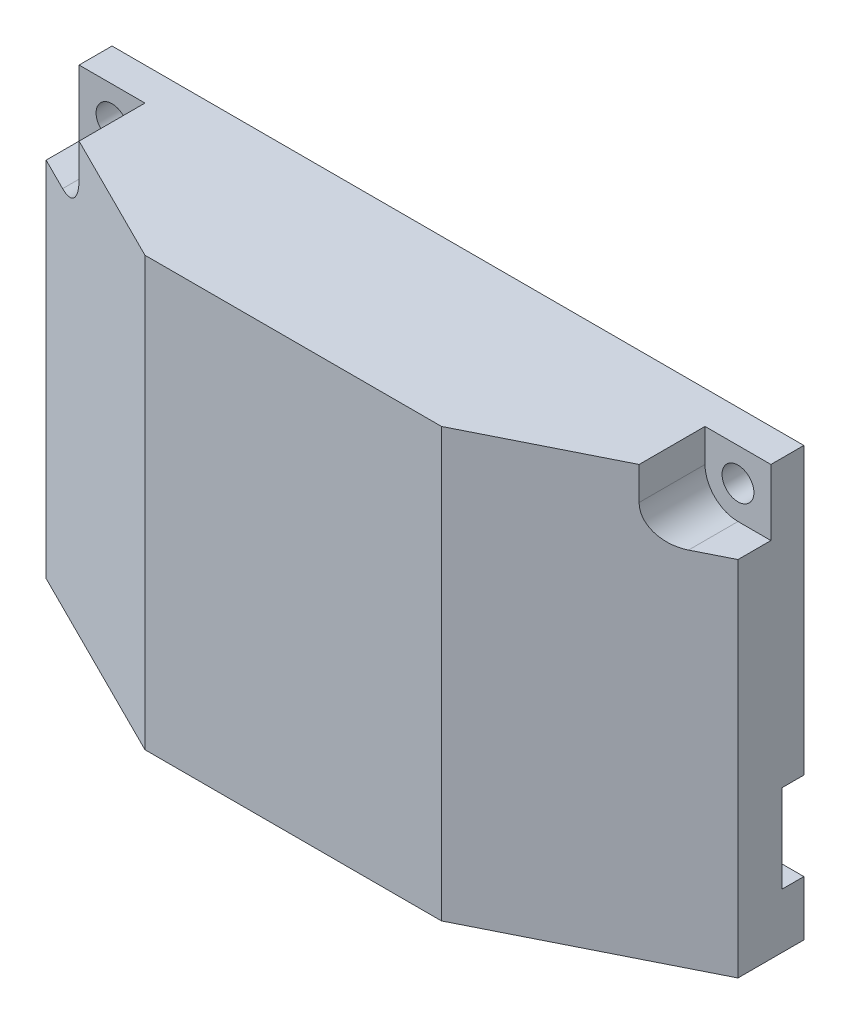
from build123d import *

# Parameters (mm, degrees)
SALIENTE_EXTRUIR1_DEPTH    = 15
CORTAR_EXTRUIR1_DEPTH      = 10
CORTAR_EXTRUIR1_DEPTH_BACK = 39
VACIADO1_T                 = -2
SALIENTE_EXTRUIR2_DEPTH    = 10
CORTAR_EXTRUIR2_DEPTH      = 39
CROQUIS9_R                 = 1.45
CORTAR_EXTRUIR3_DEPTH      = 33
CORTAR_EXTRUIR4_DEPTH      = 12
CROQUIS11_W                = 2
CROQUIS11_H                = 8
CORTAR_EXTRUIR5_DEPTH      = 2
CROQUIS14_R                = 3
SALIENTE_EXTRUIR3_DEPTH    = 8
CROQUIS15_R                = 1.45
CORTAR_EXTRUIR6_DEPTH      = 8


with BuildPart() as part:
    # Croquis1 → Saliente-Extruir1 (new body)
    with BuildSketch(Plane.XY):
        Polygon((0, 0), (0, 33), (63, 33), (63, 0), (63, -6), (0, -6), align=None)
    extrude(amount=SALIENTE_EXTRUIR1_DEPTH)

    # Croquis2 → Cortar-Extruir1 (cut, two sides: drawn at the far end of the back side and taken through both)
    with BuildSketch(Plane.XZ.offset(6).offset(-CORTAR_EXTRUIR1_DEPTH_BACK)):
        Polygon((0, 15), (0, 6), (18, 15), align=None)
        Polygon((63, 15), (63, 6), (45, 15), align=None)
    extrude(amount=CORTAR_EXTRUIR1_DEPTH + CORTAR_EXTRUIR1_DEPTH_BACK, mode=Mode.SUBTRACT)

    # Vaciado1
    vaciado1_openings = [part.faces().sort_by_distance(p)[0] for p in [
        (31.5, 13.5, 0),
    ]]
    offset(amount=VACIADO1_T, openings=vaciado1_openings, kind=Kind.INTERSECTION)

    # Croquis3 → Saliente-Extruir2 (add)
    with BuildSketch(Plane(origin=(0, 0, 0), x_dir=(-1, 0, 0), z_dir=(0, 0, -1))):
        with BuildLine():
            Line((-63, 30), (-63, 27.354248689))
            ThreePointArc((-63, 27.354248689), (-58.125593258, 26.466361738), (-56.127016654, 31))
            Line((-56.127016654, 31), (-57.171572875, 31))
            ThreePointArc((-57.171572875, 31), (-60.507305936, 32.956795679), (-63, 30))
        make_face()
        with BuildLine():
            Line((-6.872983346, 31), (-5.828427125, 31))
            ThreePointArc((-5.828427125, 31), (-0.878679656, 32.121320344), (-2, 27.171572875))
            Line((-2, 27.171572875), (-2, 26.127016654))
            ThreePointArc((-2, 26.127016654), (-5.828427125, 27.171572875), (-6.872983346, 31))
        make_face()
    extrude(amount=-SALIENTE_EXTRUIR2_DEPTH)

    # Croquis8 → Cortar-Extruir2 (cut)
    with BuildSketch(Plane.XZ.offset(6)):
        Polygon((0, 6), (0, 18.606217888), (63, 18.606217888), (63, 6), (45, 15), (18, 15), align=None)
    extrude(amount=-CORTAR_EXTRUIR2_DEPTH, mode=Mode.SUBTRACT)

    # Croquis9 → Cortar-Extruir3 (cut)
    with BuildSketch(Plane(origin=(0, 0, 0), x_dir=(-1, 0, 0), z_dir=(0, 0, -1))):
        with Locations((-60, 30)):
            Circle(CROQUIS9_R)
        with Locations((-3, 30)):
            Circle(CROQUIS9_R)
    extrude(amount=-CORTAR_EXTRUIR3_DEPTH, mode=Mode.SUBTRACT)

    # Croquis10 → Cortar-Extruir4 (cut)
    with BuildSketch(Plane.XY.offset(15)):
        with BuildLine():
            Line((6, 30), (6, 33))
            Line((6, 33), (0, 33))
            Line((0, 33), (0, 27))
            Line((0, 27), (3, 27))
            ThreePointArc((3, 27), (5.121320344, 27.878679656), (6, 30))
        make_face()
        with BuildLine():
            Line((60, 27), (63, 27))
            Line((63, 27), (63, 33))
            Line((63, 33), (57, 33))
            Line((57, 33), (57, 30))
            ThreePointArc((57, 30), (57.878679656, 27.878679656), (60, 27))
        make_face()
    extrude(amount=-CORTAR_EXTRUIR4_DEPTH, mode=Mode.SUBTRACT)

    # Croquis11 → Cortar-Extruir5 (cut)
    with BuildSketch(Plane(origin=(0, 0, 0), x_dir=(-1, 0, 0), z_dir=(0, 0, -1))):
        with Locations((-62, 3)):
            Rectangle(CROQUIS11_W, CROQUIS11_H)
    extrude(amount=-CORTAR_EXTRUIR5_DEPTH, mode=Mode.SUBTRACT)

    # Croquis14 → Saliente-Extruir3 (add)
    with BuildSketch(Plane.XZ.offset(6)):
        with Locations((31.5, 12)):
            Circle(CROQUIS14_R)
    extrude(amount=-SALIENTE_EXTRUIR3_DEPTH)

    # Croquis15 → Cortar-Extruir6 (cut)
    with BuildSketch(Plane(origin=(0, 2, 0), x_dir=(1, 0, 0), z_dir=(0, 1, 0))):
        with Locations(Location((31.5, -12, 0), (0, 0, 270))):
            Circle(CROQUIS15_R)
    extrude(amount=-CORTAR_EXTRUIR6_DEPTH, mode=Mode.SUBTRACT)


solid = part.part
